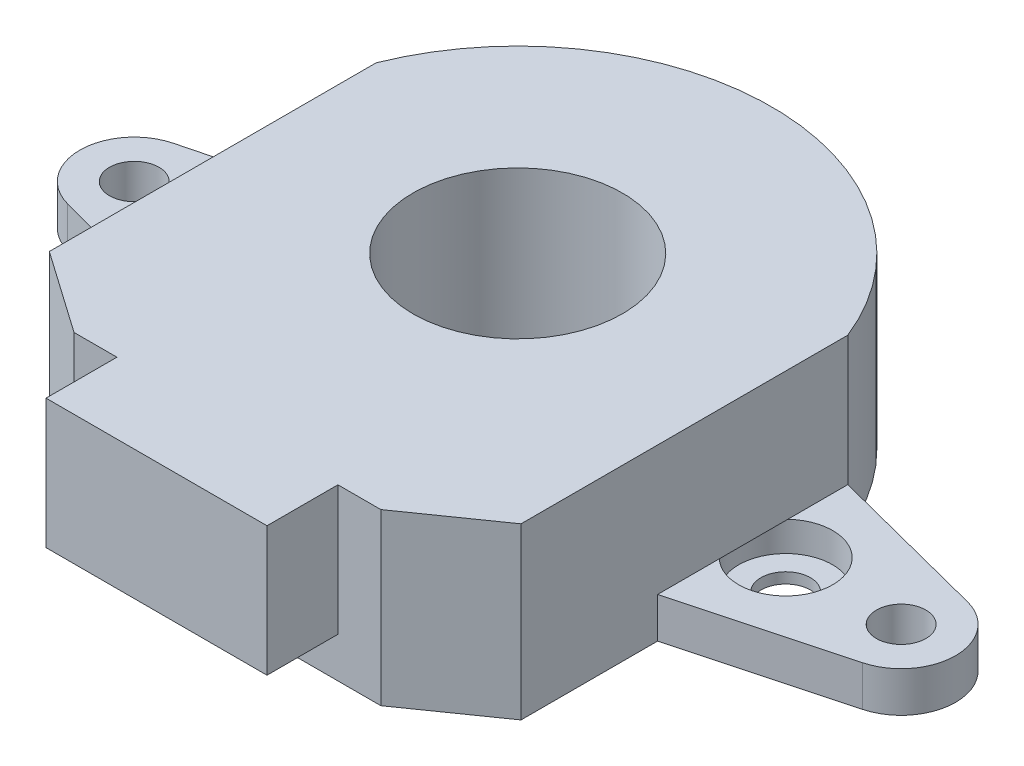
from build123d import *
from build123d.topology import SkipClean

# Parameters (mm, degrees)
SKETCH1_R           = 6.35
BOSS_EXTRUDE1_DEPTH = 2.45
SKETCH2_R           = 1.5
BOSS_EXTRUDE2_DEPTH = 2.45
SKETCH3_R           = 2.85
CUT_EXTRUDE1_DEPTH  = 1.8
CHAMFER1_SIZE       = 5
CHAMFER1_SIZE2      = 3.501037691
BOSS_EXTRUDE3_DEPTH = 7.85


with BuildPart() as part:
    # Sketch1 → Boss-Extrude1 (new body)
    with BuildSketch(Plane(origin=(0, 0, 0), x_dir=(1, 0, 0), z_dir=(0, 1, 0))):
        with BuildLine():
            Line((-14.3, -17.6), (14.3, -17.6))
            Line((14.3, -17.6), (14.3, 5.715767665))
            ThreePointArc((14.3, 5.715767665), (0, 15.4), (-14.3, 5.715767665))
            Line((-14.3, 5.715767665), (-14.3, -17.6))
        make_face()
        with Locations(Location((0, 0, 0), (0, 0, 270))):
            Circle(SKETCH1_R, mode=Mode.SUBTRACT)
    extrude(amount=BOSS_EXTRUDE1_DEPTH)

    # Sketch2 → Boss-Extrude2 (add)
    with BuildSketch(Plane(origin=(0, 0, 0), x_dir=(1, 0, 0), z_dir=(0, 1, 0))):
        with BuildLine():
            ThreePointArc((24.104102849, -3.187555227), (26.549963246, 0.015574774), (24.073976981, 3.195475228))
            Line((24.073976981, 3.195475228), (14.3, 5.715767665))
            Line((14.3, 5.715767665), (14.3, -5.814556668))
            Line((14.3, -5.814556668), (24.104102849, -3.187555227))
        make_face()
        with Locations(Location((16.25, 0, 0), (0, 0, 270))):
            Circle(SKETCH2_R, mode=Mode.SUBTRACT)
        with Locations(Location((23.25, 0, 0), (0, 0, 270))):
            Circle(SKETCH2_R, mode=Mode.SUBTRACT)
    boss_extrude2 = extrude(amount=BOSS_EXTRUDE2_DEPTH)

    # Sketch3 → Cut-Extrude1 (cut)
    with BuildSketch(Plane(origin=(0, 2.45, 0), x_dir=(1, 0, 0), z_dir=(0, 1, 0))):
        with Locations(Location((16.25, 0, 0), (0, 0, 270))):
            Circle(SKETCH3_R)
    cut_extrude1 = extrude(amount=-CUT_EXTRUDE1_DEPTH, mode=Mode.SUBTRACT)

    # Mirror1: Boss-Extrude2, Cut-Extrude1 across plane
    add(boss_extrude2.mirror(Plane(origin=(0, 0, 0), x_dir=(0, 0, 1), z_dir=(1, 0, 0))))
    add(cut_extrude1.mirror(Plane(origin=(0, 0, 0), x_dir=(0, 0, 1), z_dir=(1, 0, 0))), mode=Mode.SUBTRACT)

    # Chamfer1
    chamfer1_edges = [part.edges().sort_by_distance(p)[0] for p in [
        (-14.3, 1.225, 17.6),
        (14.3, 1.225, 17.6),
    ]]
    chamfer1_side = [part.faces().sort_by_distance(p)[0] for p in [
        (0, 1.225, 17.6),
    ]]
    chamfer(chamfer1_edges, length=CHAMFER1_SIZE, length2=CHAMFER1_SIZE2, reference=chamfer1_side[0])

    # Sketch5 → Boss-Extrude3 (add)
    with BuildSketch(Plane(origin=(0, 2.45, 0), x_dir=(1, 0, 0), z_dir=(0, 1, 0))):
        with BuildLine():
            Line((14.3, 5.715767665), (14.3, -14.098962309))
            Line((14.3, -14.098962309), (9.3, -17.6))
            Line((9.3, -17.6), (6.7, -17.6))
            Line((6.7, -17.6), (6.7, -21.9))
            Line((6.7, -21.9), (0, -21.9))
            Line((0, -21.9), (0, -6.35))
            ThreePointArc((0, -6.35), (6.35, 0), (0, 6.35))
            Line((0, 6.35), (0, 15.4))
            ThreePointArc((0, 15.4), (8.63531059, 12.751133715), (14.3, 5.715767665))
        make_face()
    boss_extrude3 = extrude(amount=BOSS_EXTRUDE3_DEPTH)

    # Mirror2: Boss-Extrude3 across plane
    with SkipClean():  # the faces are left unmerged after this step: merging them gives an invalid solid
        add(boss_extrude3.mirror(Plane(origin=(0, 0, 0), x_dir=(0, 0, 1), z_dir=(1, 0, 0))))


solid = part.part
